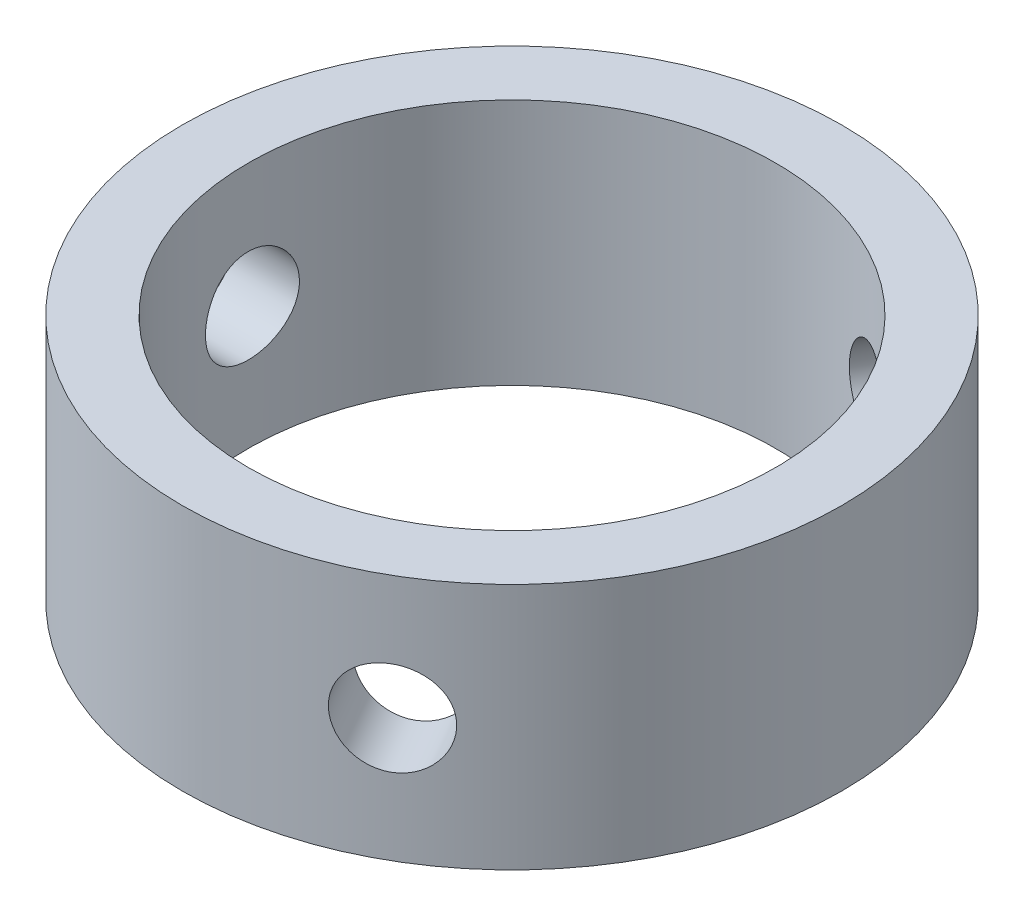
from build123d import *

# Parameters (mm, degrees)
CROQUIS1_R              = 20
CROQUIS1_R_2            = 16
SALIENTE_EXTRUIR1_DEPTH = 15
CROQUIS3_R              = 2.85
CORTAR_EXTRUIR1_DEPTH   = 33.015621187
CROQUIS7_R              = 2.85
CORTAR_EXTRUIR3_DEPTH   = 33.015621359
CROQUIS9_R              = 2.85
CORTAR_EXTRUIR5_DEPTH   = 33.015621359


with BuildPart() as part:
    # Croquis1 → Saliente-Extruir1 (new body)
    with BuildSketch(Plane(origin=(0, 0, 0), x_dir=(1, 0, 0), z_dir=(0, 1, 0))):
        Circle(CROQUIS1_R)
        Circle(CROQUIS1_R_2, mode=Mode.SUBTRACT)
    extrude(amount=SALIENTE_EXTRUIR1_DEPTH)

    # Croquis3 → Cortar-Extruir1 (cut, through all)
    with BuildSketch(Plane(origin=(0, 0, 0), x_dir=(0, 0, -1), z_dir=(1, 0, 0))):
        with Locations((0, 7.5)):
            Circle(CROQUIS3_R)
    extrude(amount=-CORTAR_EXTRUIR1_DEPTH, mode=Mode.SUBTRACT)

    # Croquis7 → Cortar-Extruir3 (cut, through all)
    with BuildSketch(Plane(origin=(0, 0, 0), x_dir=(0.8660254037844363, 0, 0.500000000000004), z_dir=(-0.5000000000000041, 0, 0.8660254037844364))):
        with Locations((0, 7.5)):
            Circle(CROQUIS7_R)
    extrude(amount=-CORTAR_EXTRUIR3_DEPTH, mode=Mode.SUBTRACT)

    # Croquis9 → Cortar-Extruir5 (cut, through all)
    with BuildSketch(Plane(origin=(0, 0, 0), x_dir=(-0.8660254037844434, 0, 0.499999999999992), z_dir=(-0.499999999999992, 0, -0.8660254037844434))):
        with Locations((0, 7.5)):
            Circle(CROQUIS9_R)
    extrude(amount=-CORTAR_EXTRUIR5_DEPTH, mode=Mode.SUBTRACT)


solid = part.part
